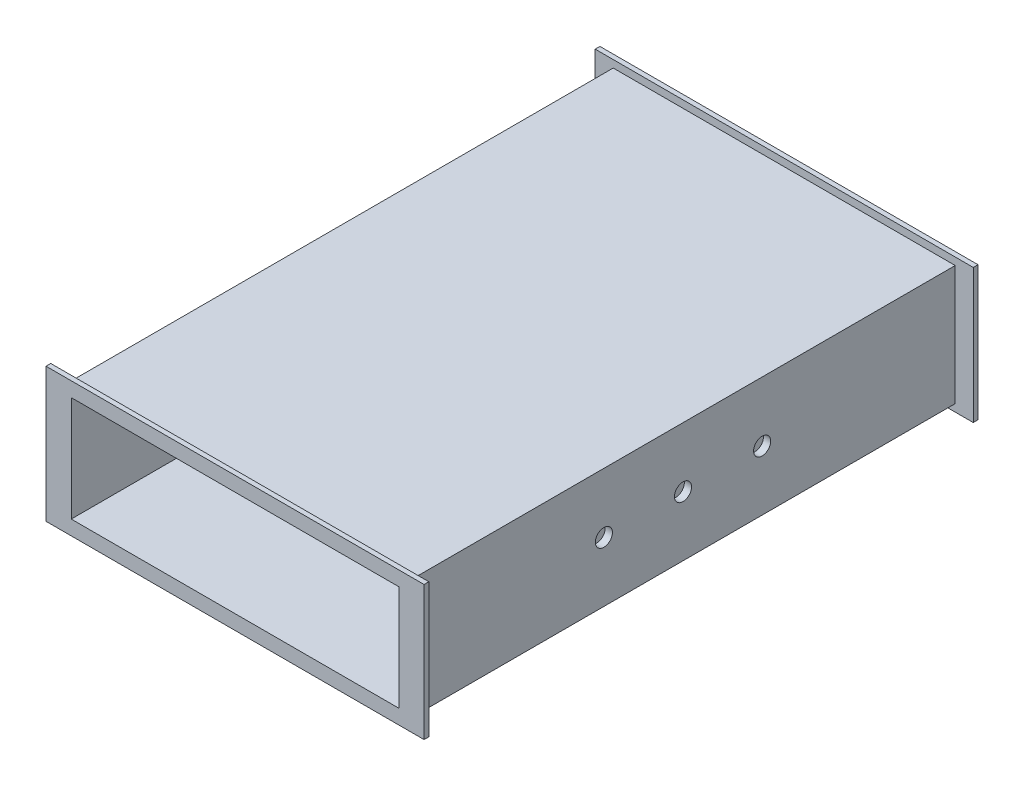
from build123d import *

# Parameters (mm, degrees)
SKETCH4_W               = 200
SKETCH4_H               = 46
BOSS_EXTRUDE3_DEPTH     = 150
SKETCH6_W               = 238.890872966
SKETCH6_H               = 84.890872966
BOSS_EXTRUDE5_DEPTH     = 3
SKETCH7_W               = 206.979658591
SKETCH7_H               = 66.466925353
CUT_EXTRUDE1_DEPTH      = 3
SKETCH8_W               = 238.890872966
SKETCH8_H               = 84.890872966
BOSS_EXTRUDE6_DEPTH     = 3
SKETCH9_W               = 206.97965549
SKETCH9_H               = 66.466922966
CUT_EXTRUDE2_DEPTH      = 3
SKETCH10_W              = 216.1024165
SKETCH10_H              = 75.589683976
SKETCH10_W_2            = 206.97965549
SKETCH10_H_2            = 66.466922966
BOSS_EXTRUDE7_DEPTH     = 344
CUT_EXTRUDE4_DEPTH      = 345.293230431
CUT_EXTRUDE4_DEPTH_BACK = 345.293230431
SKETCH14_R              = 5.4


with BuildPart() as part:
    # Sketch4 → Boss-Extrude3 (new body)
    with BuildSketch(Plane.XY):
        with Locations((100, 23)):
            Rectangle(SKETCH4_W, SKETCH4_H)
    extrude(amount=BOSS_EXTRUDE3_DEPTH)


with BuildPart() as body_2:
    # Sketch6 → Boss-Extrude5 (new body)
    with BuildSketch(Plane.XY.offset(250)):
        with Locations((100, 23)):
            Rectangle(SKETCH6_W, SKETCH6_H)
    extrude(amount=-BOSS_EXTRUDE5_DEPTH)

    # Sketch7 → Cut-Extrude1 (cut)
    with BuildSketch(Plane.XY.offset(250)):
        with Locations((100.000001551, 23.000001194)):
            Rectangle(SKETCH7_W, SKETCH7_H)
    extrude(amount=-CUT_EXTRUDE1_DEPTH, mode=Mode.SUBTRACT)



with BuildPart() as body_3:
    # Sketch8 → Boss-Extrude6 (new body)
    with BuildSketch(Plane(origin=(0, 0, -100), x_dir=(-1, 0, 0), z_dir=(0, 0, -1))):
        with Locations((-100, 23)):
            Rectangle(SKETCH8_W, SKETCH8_H)
    extrude(amount=-BOSS_EXTRUDE6_DEPTH)

    # Sketch9 → Cut-Extrude2 (cut)
    with BuildSketch(Plane(origin=(0, 0, -100), x_dir=(-1, 0, 0), z_dir=(0, 0, -1))):
        with Locations((-100, 23)):
            Rectangle(SKETCH9_W, SKETCH9_H)
    extrude(amount=-CUT_EXTRUDE2_DEPTH, mode=Mode.SUBTRACT)


with BuildPart() as body_2_1:
    add(body_2.part)

    add(body_3.part)  # Boss-Extrude7 merges body 3
    # Sketch10 → Boss-Extrude7 (add)
    with BuildSketch(Plane.XY.offset(-97)):
        with Locations((100, 23)):
            Rectangle(SKETCH10_W, SKETCH10_H)
        with Locations((100, 23)):
            Rectangle(SKETCH10_W_2, SKETCH10_H_2, mode=Mode.SUBTRACT)
    extrude(amount=BOSS_EXTRUDE7_DEPTH)


with BuildPart() as cut_extrude4_tool:
    # Sketch14 → Cut-Extrude4 (new, two sides: drawn at the far end of the back side and taken through both)
    with BuildSketch(Plane.ZY.offset(8.05120825).offset(-CUT_EXTRUDE4_DEPTH_BACK)):
        with Locations(Location((75, 23, 0), (0, 0, 270))):
            Circle(SKETCH14_R)
        with Locations(Location((125, 23, 0), (0, 0, 270))):
            Circle(SKETCH14_R)
        with Locations(Location((25, 23, 0), (0, 0, 270))):
            Circle(SKETCH14_R)
    extrude(amount=CUT_EXTRUDE4_DEPTH + CUT_EXTRUDE4_DEPTH_BACK)


with BuildPart() as part_1:
    add(part.part)

    # Cut-Extrude4: cut by cut_extrude4_tool
    add(cut_extrude4_tool.part, mode=Mode.SUBTRACT)


with BuildPart() as body_2_2:
    add(body_2_1.part)

    # Cut-Extrude4: cut by cut_extrude4_tool
    add(cut_extrude4_tool.part, mode=Mode.SUBTRACT)


solid = Compound([part_1.part, body_2_2.part])
